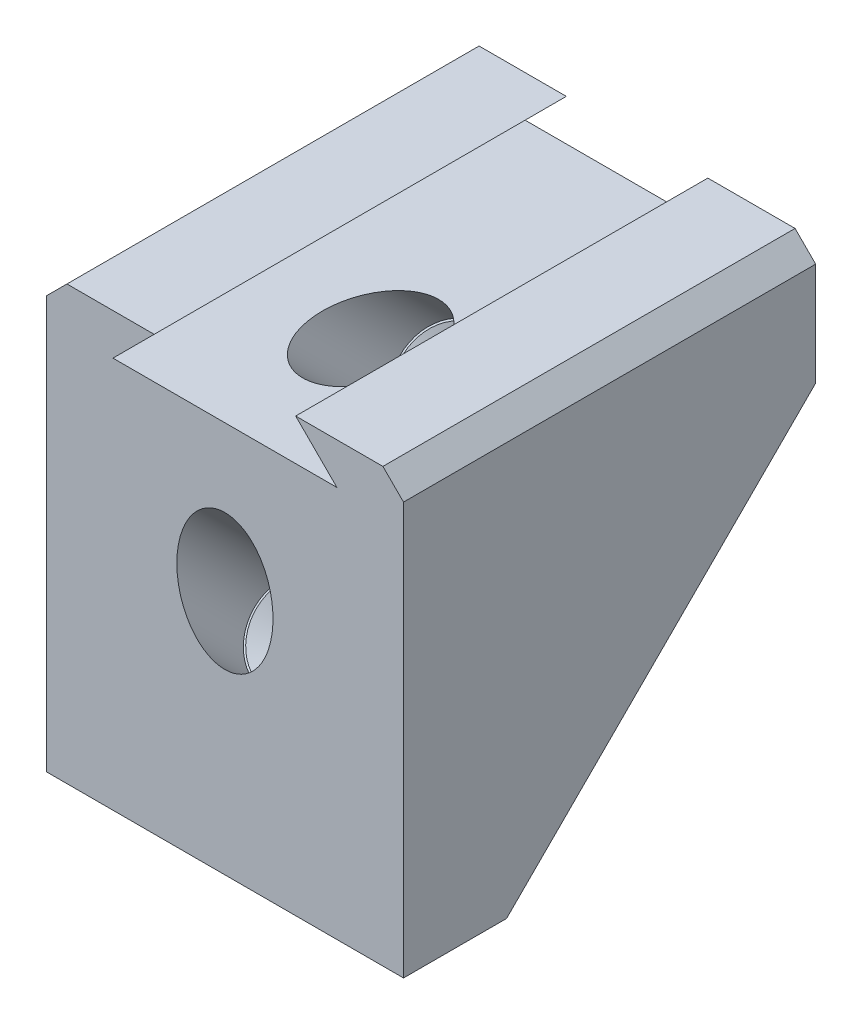
from build123d import *

# Parameters (mm, degrees)
BOSS_EXTRUDE1_DEPTH                                  = 30
BOSS_EXTRUDE2_DEPTH                                  = 26
CUT_EXTRUDE1_REACH                                   = 41.613
SKETCH8_R                                            = 3.5
CSK_FOR_M3_HEX_SOCKET_COUNTERSUNK_CAP_SC_D           = 3.4
CSK_FOR_M3_HEX_SOCKET_COUNTERSUNK_CAP_SC_CSINK_D     = 6.72
CSK_FOR_M3_HEX_SOCKET_COUNTERSUNK_CAP_SC_CSINK_ANGLE = 90


with BuildPart() as part:
    # Sketch2 → Boss-Extrude1 (new body)
    with BuildSketch(Plane.XY):
        Polygon((-13, 0), (13, 0), (13, 7.5), (11.5, 9), (5.15, 9), (8.15, 6), (-8.15, 6), (-5.15, 9), (-11.5, 9), (-13, 7.5), align=None)
    extrude(amount=BOSS_EXTRUDE1_DEPTH)

    # Sketch3 → Boss-Extrude2 (add)
    with BuildSketch(Plane(origin=(13, 0, 0), x_dir=(0, 0, -1), z_dir=(1, 0, 0))):
        Polygon((-30, 0), (-30, -22.5), (-22.5, -22.5), (0, 0), align=None)
    extrude(amount=-BOSS_EXTRUDE2_DEPTH)

    # Sketch8 → Cut-Extrude1 (cut, up to next)
    with BuildSketch(Plane(origin=(0, 7.071067812, 7.071067812), x_dir=(1, 0, 0), z_dir=(0, 0.7071067811865462, 0.7071067811865489)), mode=Mode.PRIVATE) as cut_extrude1_sk1:
        with Locations(Location((0, -9.470562748, 0), (0, 0, 90))):
            Circle(SKETCH8_R)
    cut_extrude1_tool1 = extrude(cut_extrude1_sk1.sketch, amount=CUT_EXTRUDE1_REACH, mode=Mode.PRIVATE) & part.part
    # Sketch8 → Cut-Extrude1 (cut, up to next)
    with BuildSketch(Plane(origin=(0, 7.071067812, 7.071067812), x_dir=(1, 0, 0), z_dir=(0, 0.7071067811865462, 0.7071067811865489)), mode=Mode.PRIVATE) as cut_extrude1_sk2:
        with Locations(Location((0, -24.470562748, 0), (0, 0, 270))):
            Circle(SKETCH8_R)
    cut_extrude1_tool2 = extrude(cut_extrude1_sk2.sketch, amount=CUT_EXTRUDE1_REACH, mode=Mode.PRIVATE) & part.part
    add(cut_extrude1_tool1.solids().sort_by_distance((0, 0.374369, 13.767767))[0], mode=Mode.SUBTRACT)
    add(cut_extrude1_tool2.solids().sort_by_distance((0, -10.232233, 24.374369))[0], mode=Mode.SUBTRACT)

    # CSK for M3 Hex Socket Countersunk Cap Screw3 (through all)
    with Locations(Plane(origin=(0, 7.071067812, 7.071067812), x_dir=(1, 0, 0), z_dir=(0, 0.7071067811865462, 0.7071067811865489))):
        with Locations((0, -9.470562748), (0, -24.470562748)):
            CounterSinkHole(CSK_FOR_M3_HEX_SOCKET_COUNTERSUNK_CAP_SC_D / 2, CSK_FOR_M3_HEX_SOCKET_COUNTERSUNK_CAP_SC_CSINK_D / 2, counter_sink_angle=CSK_FOR_M3_HEX_SOCKET_COUNTERSUNK_CAP_SC_CSINK_ANGLE)


solid = part.part
